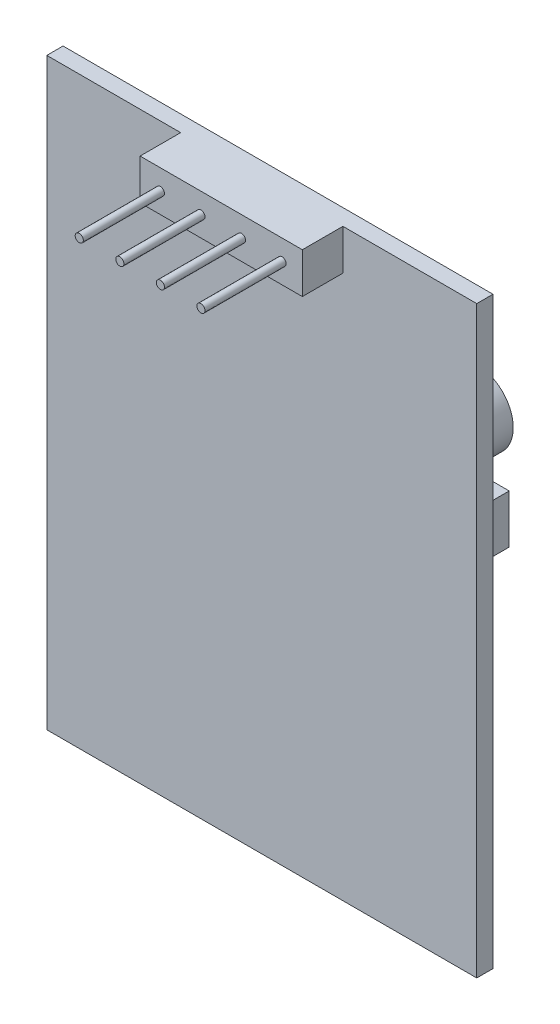
from build123d import *

# Parameters (mm, degrees)
ESQUISSE1_W             = 26.5
ESQUISSE1_H             = 36
BOSS_EXTRU_1_DEPTH      = 1
ESQUISSE2_W             = 10
ESQUISSE2_H             = 2.5
BOSS_EXTRU_2_DEPTH      = 2.5
BOSS_EXTRU_3_DEPTH      = 5
BOSS_EXTRU_3_DEPTH_BACK = 4
ESQUISSE3_R             = 0.25
ESQUISSE4_W             = 1
ESQUISSE4_H             = 3
ESQUISSE4_H_2           = 2
ESQUISSE4_W_2           = 0.5
ESQUISSE4_H_3           = 1.5
ESQUISSE4_W_3           = 1.5
ESQUISSE4_H_4           = 1
BOSS_EXTRU_4_DEPTH      = 0.5
ESQUISSE5_R             = 2
BOSS_EXTRU_5_DEPTH      = 0.5
ESQUISSE6_R             = 2.25
BOSS_EXTRU_6_DEPTH      = 1.5
ESQUISSE7_W             = 15
ESQUISSE7_H             = 11.6
ESQUISSE7_W_2           = 2
ESQUISSE7_H_2           = 3
BOSS_EXTRU_7_DEPTH      = 2
ESQUISSE8_R             = 1.2
ESQUISSE8_R_2           = 1.05
ESQUISSE8_W             = 0.573696965
ESQUISSE8_H             = 1.577666654
ESQUISSE8_W_2           = 0.5
ESQUISSE8_H_2           = 1.5
ESQUISSE8_W_3           = 3
ESQUISSE8_H_3           = 1
BOSS_EXTRU_8_DEPTH      = 0.5


with BuildPart() as part:
    # Esquisse1 → Boss.-Extru.1 (new body)
    with BuildSketch(Plane.XY):
        with Locations((-13.25, 18)):
            Rectangle(ESQUISSE1_W, ESQUISSE1_H)
    extrude(amount=BOSS_EXTRU_1_DEPTH)

    # Esquisse2 → Boss.-Extru.2 (add)
    with BuildSketch(Plane.XY.offset(1)):
        with Locations((-13.25, 34.75)):
            Rectangle(ESQUISSE2_W, ESQUISSE2_H)
    extrude(amount=BOSS_EXTRU_2_DEPTH)

    # Esquisse3 → Boss.-Extru.3 (add, two sides: drawn at the far end of the back side and taken through both)
    with BuildSketch(Plane.XY.offset(3.5).offset(-BOSS_EXTRU_3_DEPTH_BACK)):
        with Locations((-17, 34.75)):
            Circle(ESQUISSE3_R)
        with Locations((-14.5, 34.75)):
            Circle(ESQUISSE3_R)
        with Locations((-12, 34.75)):
            Circle(ESQUISSE3_R)
        with Locations((-9.5, 34.75)):
            Circle(ESQUISSE3_R)
    extrude(amount=BOSS_EXTRU_3_DEPTH + BOSS_EXTRU_3_DEPTH_BACK)

    # Esquisse4 → Boss.-Extru.4 (add)
    with BuildSketch(Plane(origin=(0, 0, 0), x_dir=(-1, 0, 0), z_dir=(0, 0, -1))):
        with Locations((7.3, 31.311243574)):
            Rectangle(ESQUISSE4_W, ESQUISSE4_H)
        with Locations((9.3, 31.311243574)):
            Rectangle(ESQUISSE4_W, ESQUISSE4_H_2)
        with Locations((11.3, 31.311243574)):
            Rectangle(ESQUISSE4_W, ESQUISSE4_H_2)
        with Locations((13.05, 31.311243574)):
            Rectangle(ESQUISSE4_W_2, ESQUISSE4_H_3)
        with Locations((15.05, 31.311243574)):
            Rectangle(ESQUISSE4_W_3, ESQUISSE4_H_2)
        with Locations((17.05, 31.311243574)):
            Rectangle(ESQUISSE4_W_2, ESQUISSE4_H_4)
    extrude(amount=BOSS_EXTRU_4_DEPTH)

    # Esquisse5 → Boss.-Extru.5 (add)
    with BuildSketch(Plane(origin=(0, 0, 0), x_dir=(-1, 0, 0), z_dir=(0, 0, -1))):
        with Locations(Location((3, 27.5, 0), (0, 0, 180))):
            Circle(ESQUISSE5_R)
    extrude(amount=BOSS_EXTRU_5_DEPTH)

    # Esquisse6 → Boss.-Extru.6 (add)
    with BuildSketch(Plane(origin=(0, 0, -0.5), x_dir=(-1, 0, 0), z_dir=(0, 0, -1))):
        with Locations((3, 27.5)):
            Circle(ESQUISSE6_R)
    extrude(amount=BOSS_EXTRU_6_DEPTH)

    # Esquisse7 → Boss.-Extru.7 (add)
    with BuildSketch(Plane(origin=(0, 0, 0), x_dir=(-1, 0, 0), z_dir=(0, 0, -1))):
        with Locations((13, 16.3)):
            Rectangle(ESQUISSE7_W, ESQUISSE7_H)
        with Locations((2, 22.5)):
            Rectangle(ESQUISSE7_W_2, ESQUISSE7_H_2)
    extrude(amount=BOSS_EXTRU_7_DEPTH)

    # Esquisse8 → Boss.-Extru.8 (add)
    # profile 1 of 6: a face of its own
    with BuildSketch(Plane(origin=(0, 0, 0), x_dir=(-1, 0, 0), z_dir=(0, 0, -1))):
        with Locations(Location((17.5, 3, 0), (0, 0, 180))):
            Circle(ESQUISSE8_R)
        with Locations((17.5, 3)):
            Circle(ESQUISSE8_R_2, mode=Mode.SUBTRACT)
    # profile 2 of 6: a face of its own
    with BuildSketch(Plane(origin=(0, 0, 0), x_dir=(-1, 0, 0), z_dir=(0, 0, -1))):
        with Locations((3.927424315, 22.3983434)):
            Rectangle(ESQUISSE8_W, ESQUISSE8_H)
    # profile 3 of 6: a face of its own
    with BuildSketch(Plane(origin=(0, 0, 0), x_dir=(-1, 0, 0), z_dir=(0, 0, -1))):
        with Locations((1.404555649, 7.75)):
            Rectangle(ESQUISSE8_W_2, ESQUISSE8_H_2)
    # profile 4 of 6: a face of its own
    with BuildSketch(Plane(origin=(0, 0, 0), x_dir=(-1, 0, 0), z_dir=(0, 0, -1))):
        with Locations((2.886606143, 7.75)):
            Rectangle(ESQUISSE8_W_2, ESQUISSE8_H_2)
    # profile 5 of 6: a face of its own
    with BuildSketch(Plane(origin=(0, 0, 0), x_dir=(-1, 0, 0), z_dir=(0, 0, -1))):
        with Locations((15.25, 7.25)):
            Rectangle(ESQUISSE8_W_2, ESQUISSE8_H_2)
    # profile 6 of 6: a face of its own
    with BuildSketch(Plane(origin=(0, 0, 0), x_dir=(-1, 0, 0), z_dir=(0, 0, -1))):
        with Locations((17.7, 6.5)):
            Rectangle(ESQUISSE8_W_3, ESQUISSE8_H_3)
    extrude(amount=BOSS_EXTRU_8_DEPTH)


solid = part.part
